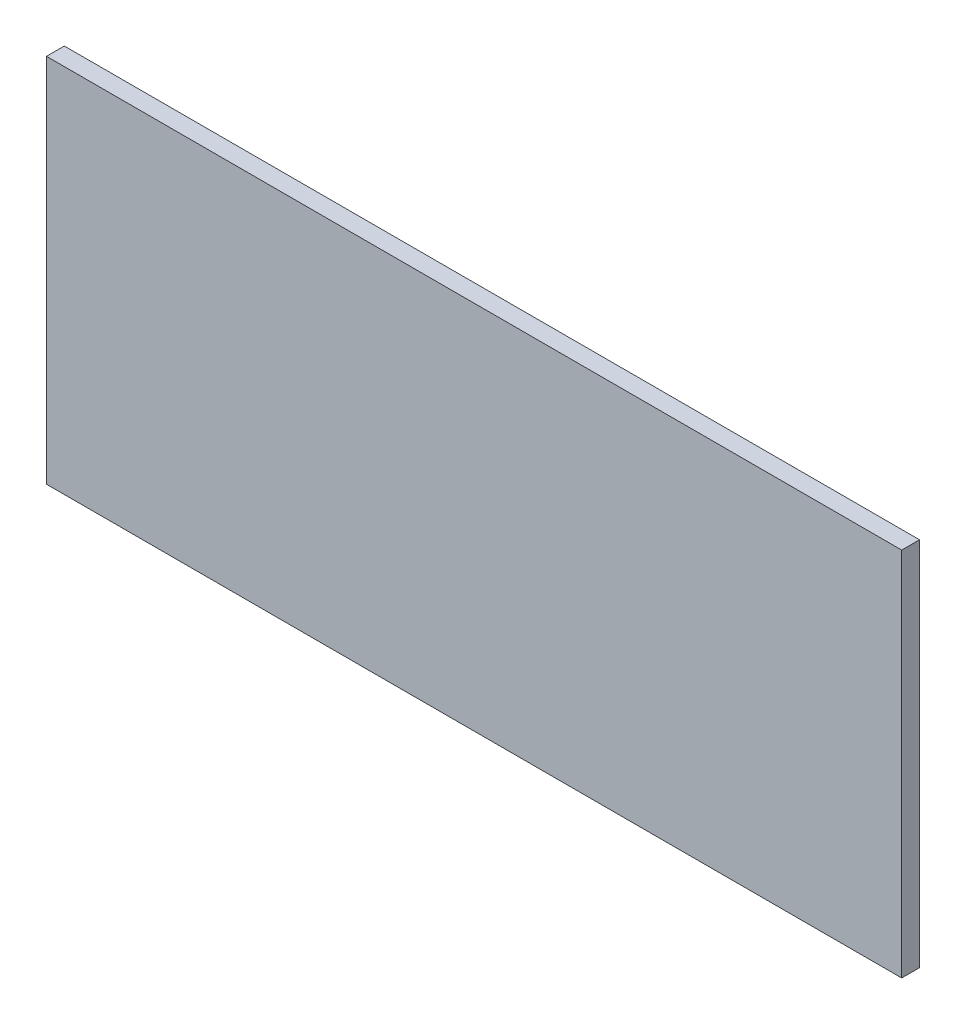
from build123d import *

# Parameters (mm, degrees)
SKETCH2_W           = 152.4
SKETCH2_H           = 66.04
BOSS_EXTRUDE1_DEPTH = 3.175


with BuildPart() as part:
    # Sketch2 → Boss-Extrude1 (new body)
    with BuildSketch(Plane.XY):
        with Locations((-76.2, 33.02)):
            Rectangle(SKETCH2_W, SKETCH2_H)
    extrude(amount=BOSS_EXTRUDE1_DEPTH)


solid = part.part
